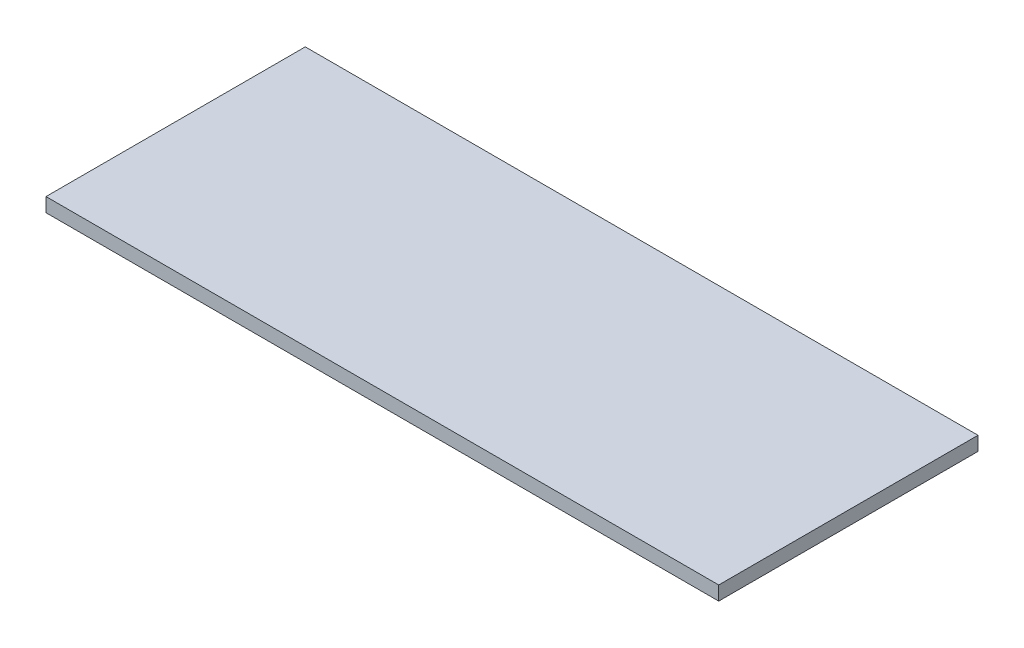
from build123d import *

# Parameters (mm, degrees)
SKETCH1_W           = 609.6
SKETCH1_H           = 234.95
BOSS_EXTRUDE1_DEPTH = 12.7


with BuildPart() as part:
    # Sketch1 → Boss-Extrude1 (new body)
    with BuildSketch(Plane(origin=(0, 0, 0), x_dir=(1, 0, 0), z_dir=(0, 1, 0))):
        with Locations((0, 117.475)):
            Rectangle(SKETCH1_W, SKETCH1_H)
    extrude(amount=BOSS_EXTRUDE1_DEPTH)


solid = part.part
